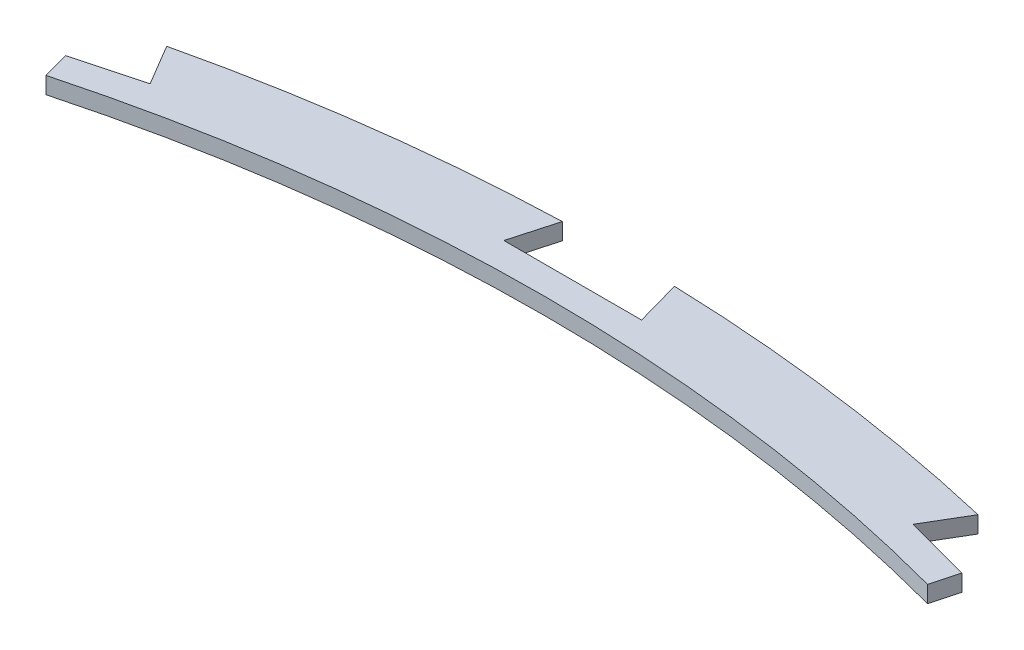
from build123d import *

# Parameters (mm, degrees)
BOSS_EXTRUDE1_DEPTH = 9


with BuildPart() as part:
    # Sketch1 → Boss-Extrude1 (new body)
    with BuildSketch(Plane(origin=(0, 0, 0), x_dir=(1, 0, 0), z_dir=(0, 1, 0))):
        with BuildLine():
            Line((-240.701711945, 898.311018449), (-236.819426269, 883.822131054))
            ThreePointArc((-236.819426269, 883.822131055), (0, 915), (236.819426269, 883.822131055))
            Line((236.819426269, 883.822131054), (240.701711945, 898.311018449))
            Line((240.701711945, 898.311018449), (204.962456373, 907.887323118))
            Line((204.962456373, 907.887323118), (217.942733848, 929.79888404))
            ThreePointArc((217.942733848, 929.79888404), (124.65251357, 946.829842612), (30.133144029, 954.524485611))
            Line((30.133144029, 954.524485611), (37, 930))
            Line((37, 930), (-37, 930))
            Line((-37, 930), (-30.133144029, 954.524485611))
            ThreePointArc((-30.133144029, 954.524485611), (-124.65251357, 946.829842612), (-217.942733848, 929.79888404))
            Line((-217.942733848, 929.79888404), (-204.962456373, 907.887323118))
            Line((-204.962456373, 907.887323118), (-240.701711945, 898.311018449))
        make_face()
    extrude(amount=BOSS_EXTRUDE1_DEPTH)


solid = part.part
